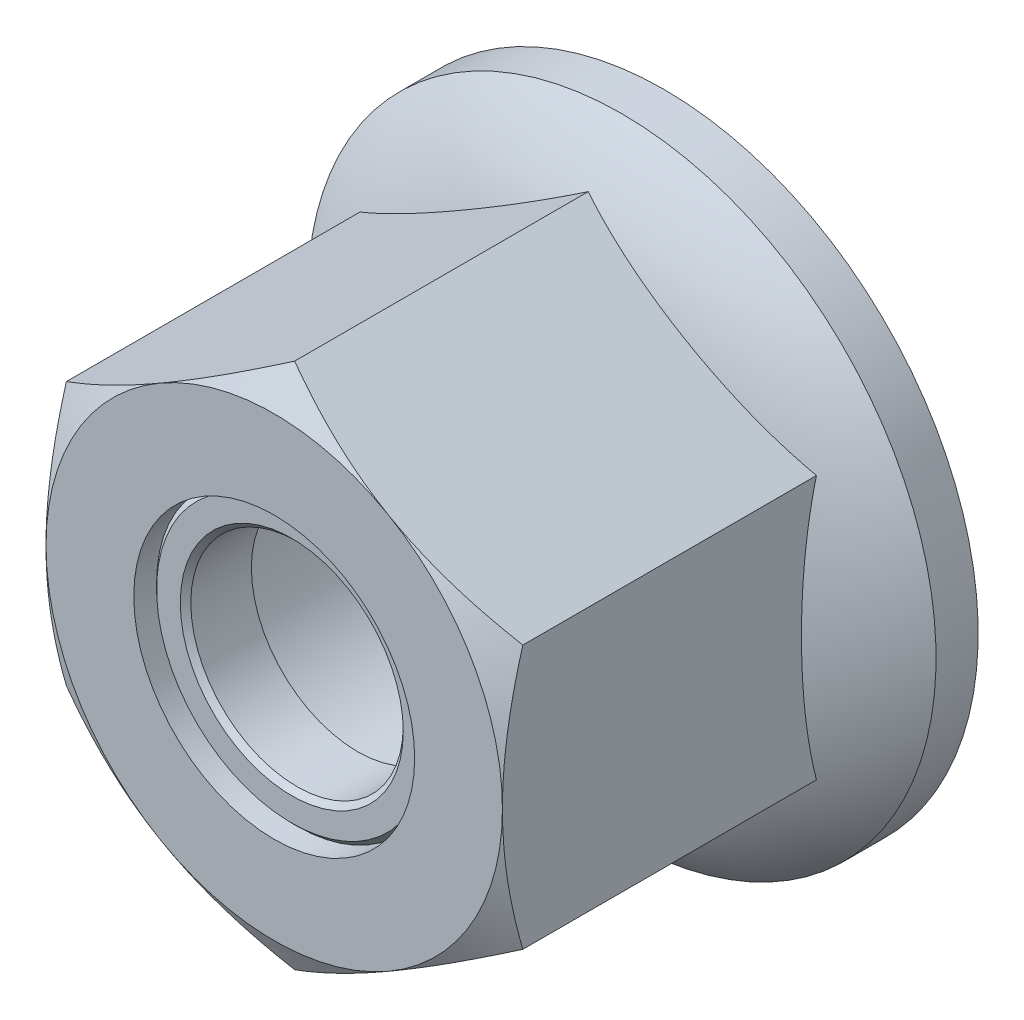
from build123d import *

# Parameters (mm, degrees)
SKETCH1_R           = 4
EXTRUDE1_DEPTH      = 11.1
SKETCH2_OUTSIDE_W   = 74.604
SKETCH2_OUTSIDE_H   = 76.616
SKETCH2_OUTSIDE_R   = 6.5
CUT_EXTRUDE1_DEPTH  = 15.892727532
CUT_EXTRUDE1_DRAFT  = -60
BOSS_EXTRUDE1_START = -0.5
SKETCH10_R          = 4
SKETCH10_R_2        = 3.025721421
BOSS_EXTRUDE1_DEPTH = 1.875
CHAMFER1_SIZE       = 0.15


with BuildPart() as part:
    # Sketch1 → Extrude1 (new body)
    with BuildSketch(Plane.XY):
        Polygon((0, 7.505553499), (-6.5, 3.75277675), (-6.5, -3.75277675), (0, -7.505553499), (6.5, -3.75277675), (6.5, 3.75277675), align=None)
        Circle(SKETCH1_R, mode=Mode.SUBTRACT)
    extrude(amount=-EXTRUDE1_DEPTH)


with BuildPart() as cut_extrude1_tool:
    # Sketch2 outside → Cut-Extrude1 (with draft: the straight prism first)
    with BuildSketch(Plane.XY):
        Rectangle(SKETCH2_OUTSIDE_W, SKETCH2_OUTSIDE_H)
        Circle(SKETCH2_OUTSIDE_R, mode=Mode.SUBTRACT)
    extrude(amount=-CUT_EXTRUDE1_DEPTH)
    # Cut-Extrude1: the draft: its side faces are tilted about the plane it starts from
    cut_extrude1_sides = [cut_extrude1_tool.faces().sort_by_distance(p)[0] for p in [
        (0, -38.308, -7.946363766),
        (37.302, 0, -7.946363766),
        (0, 38.308, -7.946363766),
        (-37.302, 0, -7.946363766),
        (-6.5, 0, -7.946363766),
    ]]
    draft(cut_extrude1_sides, Plane.XY, CUT_EXTRUDE1_DRAFT)


with BuildPart() as part_1:
    add(part.part)

    # Cut-Extrude1: cut by cut_extrude1_tool
    add(cut_extrude1_tool.part, mode=Mode.SUBTRACT)

    # Sketch3 → Revolve1 (revolve)
    with BuildSketch(Plane(origin=(0, 0, 0), x_dir=(0, 0, -1), z_dir=(1, 0, 0))):
        with BuildLine():
            Line((11.1, 8.95), (11.1, 4))
            Line((11.1, 4), (8.1, 4))
            ThreePointArc((8.1, 4), (8.56396693, 6.63355748), (9.9, 8.95))
            Line((9.9, 8.95), (11.1, 8.95))
        make_face()
    revolve(axis=Axis((0, 0, 0), (0, 0, -1)))


with BuildPart() as body_2:
    # Sketch10 → Boss-Extrude1 (new body)
    with BuildSketch(Plane.XY.offset(BOSS_EXTRUDE1_START)):
        Circle(SKETCH10_R)
        Circle(SKETCH10_R_2, mode=Mode.SUBTRACT)
    extrude(amount=-BOSS_EXTRUDE1_DEPTH)

    # Chamfer1
    chamfer1_edges = [body_2.edges().sort_by_distance(p)[0] for p in [
        (-4, 0, -0.5),
        (-3.025721421, 0, -0.5),
    ]]
    chamfer(chamfer1_edges, length=CHAMFER1_SIZE)


solid = Compound([part_1.part, body_2.part])
